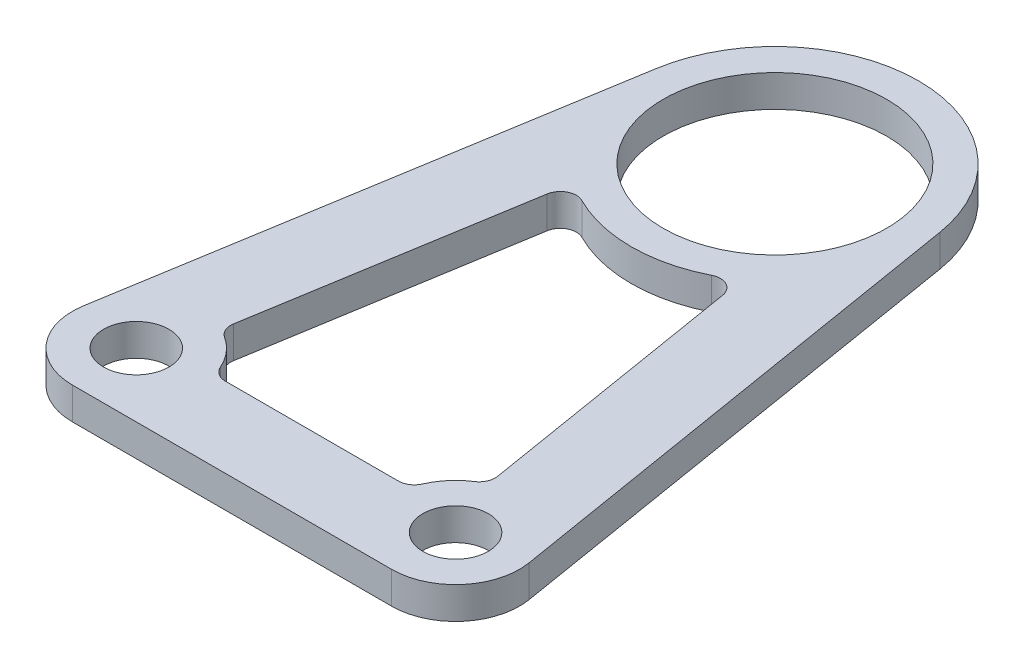
from build123d import *

# Parameters (mm, degrees)
SKETCH1_R           = 7
SKETCH1_R_2         = 2.05
BOSS_EXTRUDE1_DEPTH = 2


with BuildPart() as part:
    # Sketch1 → Boss-Extrude1 (new body)
    with BuildSketch(Plane(origin=(0, 0, 0), x_dir=(1, 0, 0), z_dir=(0, 1, 0))):
        with BuildLine():
            Line((-8.880747298, 1.460249099), (-13.946998799, -29.3510004))
            ThreePointArc((-13.946998799, -29.3510004), (-13.049262075, -32.588822281), (-10, -34))
            Line((-10, -34), (10, -34))
            ThreePointArc((10, -34), (13.049262075, -32.588822281), (13.946998799, -29.3510004))
            Line((13.946998799, -29.3510004), (8.880747298, 1.460249099))
            ThreePointArc((8.880747298, 1.460249099), (0, 9), (-8.880747298, 1.460249099))
        make_face()
        with Locations(Location((0, 0, 0), (0, 0, 270))):
            Circle(SKETCH1_R, mode=Mode.SUBTRACT)
        with Locations(Location((-10, -30, 0), (0, 0, 270))):
            Circle(SKETCH1_R_2, mode=Mode.SUBTRACT)
        with Locations(Location((10, -30, 0), (0, 0, 90))):
            Circle(SKETCH1_R_2, mode=Mode.SUBTRACT)
        with BuildLine():
            Line((-5.494764199, -8.763992606), (-8.269727852, -25.640394709))
            ThreePointArc((-8.269727852, -25.640394709), (-8.197420113, -26.207361672), (-7.826382522, -26.642115687))
            ThreePointArc((-7.826382522, -26.642115687), (-6.950737925, -27.411177719), (-6.333939444, -28.4))
            ThreePointArc((-6.333939444, -28.4), (-5.965146863, -28.836660027), (-5.417424305, -29))
            Line((-5.417424305, -29), (5.417424305, -29))
            ThreePointArc((5.417424305, -29), (5.965146863, -28.836660027), (6.333939444, -28.4))
            ThreePointArc((6.333939444, -28.4), (6.950737925, -27.411177719), (7.826382522, -26.642115687))
            ThreePointArc((7.826382522, -26.642115687), (8.197420113, -26.207361672), (8.269727852, -25.640394709))
            Line((8.269727852, -25.640394709), (5.494764199, -8.763992606))
            ThreePointArc((5.494764199, -8.763992606), (4.960973443, -8.03471113), (4.057213049, -8.033618256))
            ThreePointArc((4.057213049, -8.033618256), (0, -9), (-4.057213049, -8.033618256))
            ThreePointArc((-4.057213049, -8.033618256), (-4.960973443, -8.03471113), (-5.494764199, -8.763992606))
        make_face(mode=Mode.SUBTRACT)
    extrude(amount=BOSS_EXTRUDE1_DEPTH)


solid = part.part
